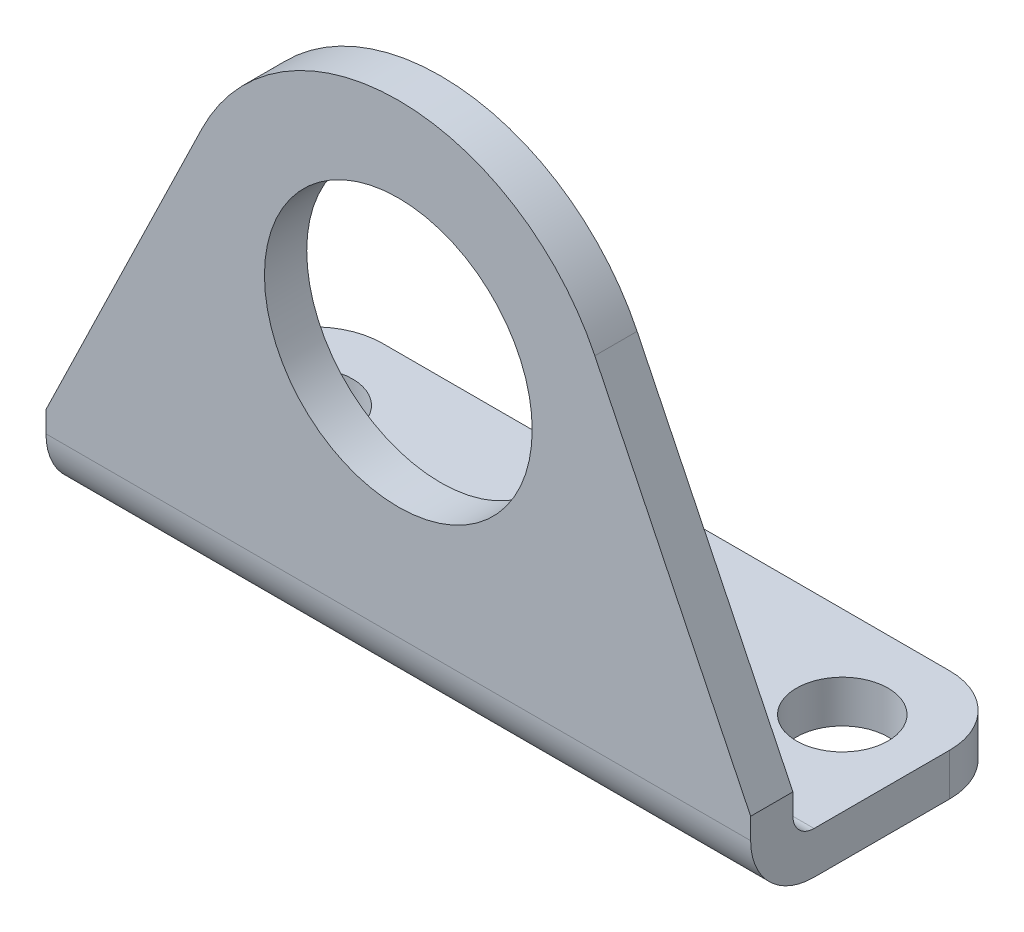
from build123d import *

# Parameters (mm, degrees)
BOSS_EXTRUDE1_DEPTH      = 6.35
BOSS_EXTRUDE1_DEPTH_BACK = 3.302
SKETCH3_R                = 4.826
SKETCH4_R                = 1.651
CUT_EXTRUDE1_DEPTH       = 24.759524406
CUT_EXTRUDE2_DEPTH       = 33.378773911
FILLET1_R                = 2.4765


with BuildPart() as part:
    # Sketch3 → Boss-Extrude1 (new, two sides: drawn at the far end of the back side and taken through both)
    with BuildSketch(Plane.XY.offset(-BOSS_EXTRUDE1_DEPTH_BACK)):
        with BuildLine():
            Line((-12.7, 0), (12.7, 0))
            Line((12.7, 0), (12.7, 3.048))
            Line((12.7, 3.048), (7.083102209, 14.615409702))
            ThreePointArc((7.083102209, 14.615409702), (0, 19.05), (-7.083102209, 14.615409702))
            Line((-7.083102209, 14.615409702), (-12.7, 3.048))
            Line((-12.7, 3.048), (-12.7, 0))
        make_face()
        with Locations((0, 11.176)):
            Circle(SKETCH3_R, mode=Mode.SUBTRACT)
    extrude(amount=BOSS_EXTRUDE1_DEPTH + BOSS_EXTRUDE1_DEPTH_BACK)

    # Sketch4 → Cut-Extrude1 (cut, through all)
    with BuildSketch(Plane(origin=(0, 0, 0), x_dir=(1, 0, 0), z_dir=(0, 1, 0))):
        with Locations((9.652, 0)):
            Circle(SKETCH4_R)
        with Locations(Location((-9.652, 0, 0), (0, 0, 180))):
            Circle(SKETCH4_R)
    extrude(amount=CUT_EXTRUDE1_DEPTH, mode=Mode.SUBTRACT)

    # Sketch5 → Cut-Extrude2 (cut, through all)
    with BuildSketch(Plane.ZY.offset(12.7)):
        with BuildLine():
            Line((-3.302, 19.05), (4.826, 19.05))
            Line((4.826, 19.05), (4.826, 2.286))
            ThreePointArc((4.826, 2.286), (4.602815367, 1.747184633), (4.064, 1.524))
            Line((4.064, 1.524), (-3.302, 1.524))
            Line((-3.302, 1.524), (-3.302, 19.05))
        make_face()
        with BuildLine():
            Line((4.064, 0), (6.35, 0))
            Line((6.35, 0), (6.35, 2.286))
            ThreePointArc((6.35, 2.286), (5.680446102, 0.669553898), (4.064, 0))
        make_face()
    extrude(amount=-CUT_EXTRUDE2_DEPTH, mode=Mode.SUBTRACT)

    # Fillet1
    fillet1_edges = [part.edges().sort_by_distance(p)[0] for p in [
        (12.7, 0.762, -3.302),
        (-12.7, 0.762, -3.302),
    ]]
    fillet(fillet1_edges, radius=FILLET1_R)


solid = part.part
